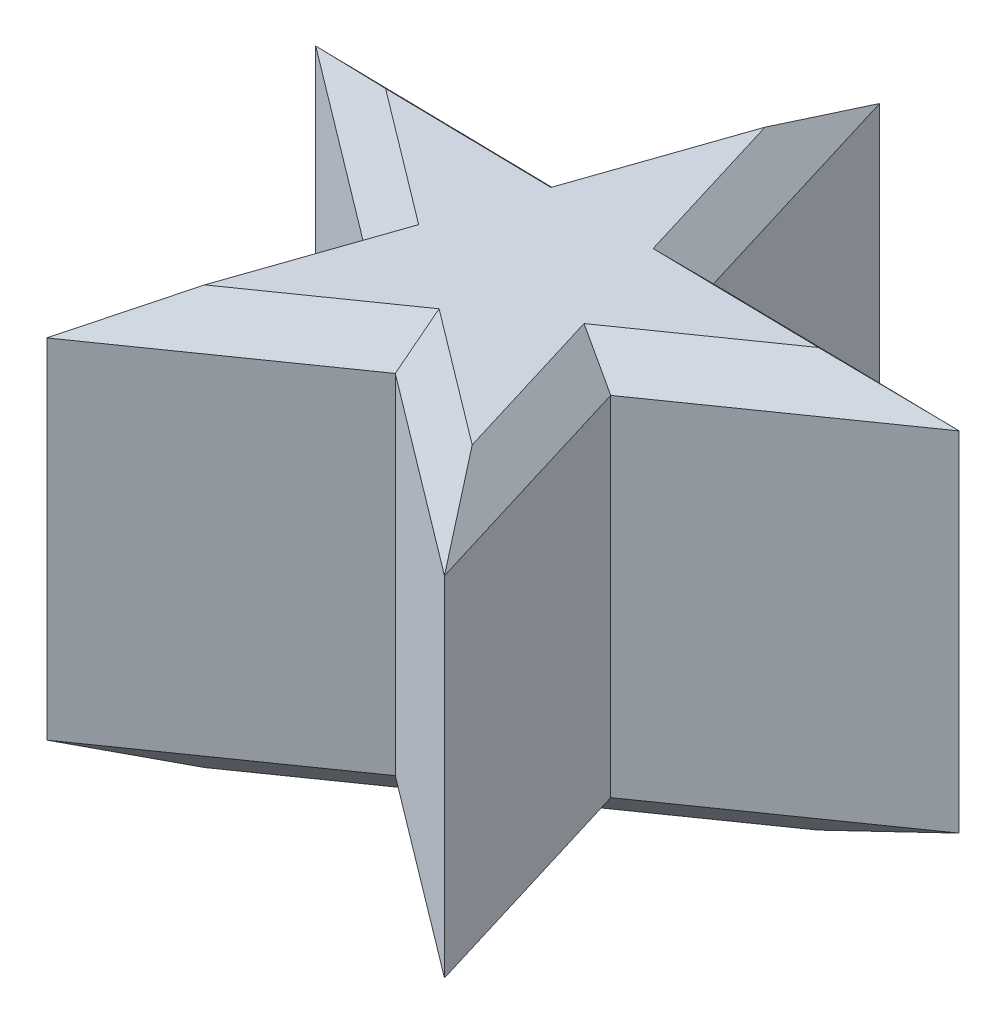
from build123d import *

# Parameters (mm, degrees)
BOSS_EXTRUDE1_DEPTH = 3
CHAMFER1_SIZE       = 0.5


with BuildPart() as part:
    # Sketch1 → Boss-Extrude1 (new, symmetric)
    with BuildSketch(Plane(origin=(0, 0, 0), x_dir=(1, 0, 0), z_dir=(0, 1, 0))):
        Polygon((-4.674503569, 1.610851049), (-1.08284245, 1.547271789), (0.087509344, 4.943497429), (1.136926198, 1.507977646), (4.728587318, 1.444398386), (1.785501483, -0.61529035), (2.834918338, -4.050810134), (-0.033425595, -1.888247995), (-2.97651143, -3.94793673), (-1.806159637, -0.55171109), align=None)
    extrude(amount=BOSS_EXTRUDE1_DEPTH, both=True)

    # Chamfer1
    chamfer1_edges = [part.edges().sort_by_distance(p)[0] for p in [
        (0.612217771, -3, -3.225737537),
        (2.932756758, -3, -1.476188016),
        (3.2570444, -3, -0.414554018),
        (2.31020991, -3, 2.333050242),
        (1.400746371, -3, 2.969529064),
        (-1.504968513, -3, 2.918092363),
        (-2.391335533, -3, 2.24982391),
        (-3.240331603, 3, -0.529569979),
        (-3.240331603, -3, -0.529569979),
        (-2.878673009, -3, -1.579061419),
        (-0.497666553, -3, -3.245384609),
        (-2.391335533, 3, 2.24982391),
        (-1.504968513, 3, 2.918092363),
        (1.400746371, 3, 2.969529064),
        (2.31020991, 3, 2.333050242),
        (3.2570444, 3, -0.414554018),
        (2.932756758, 3, -1.476188016),
        (0.612217771, 3, -3.225737537),
        (-0.497666553, 3, -3.245384609),
        (-2.878673009, 3, -1.579061419),
    ]]
    chamfer(chamfer1_edges, length=CHAMFER1_SIZE)


solid = part.part
